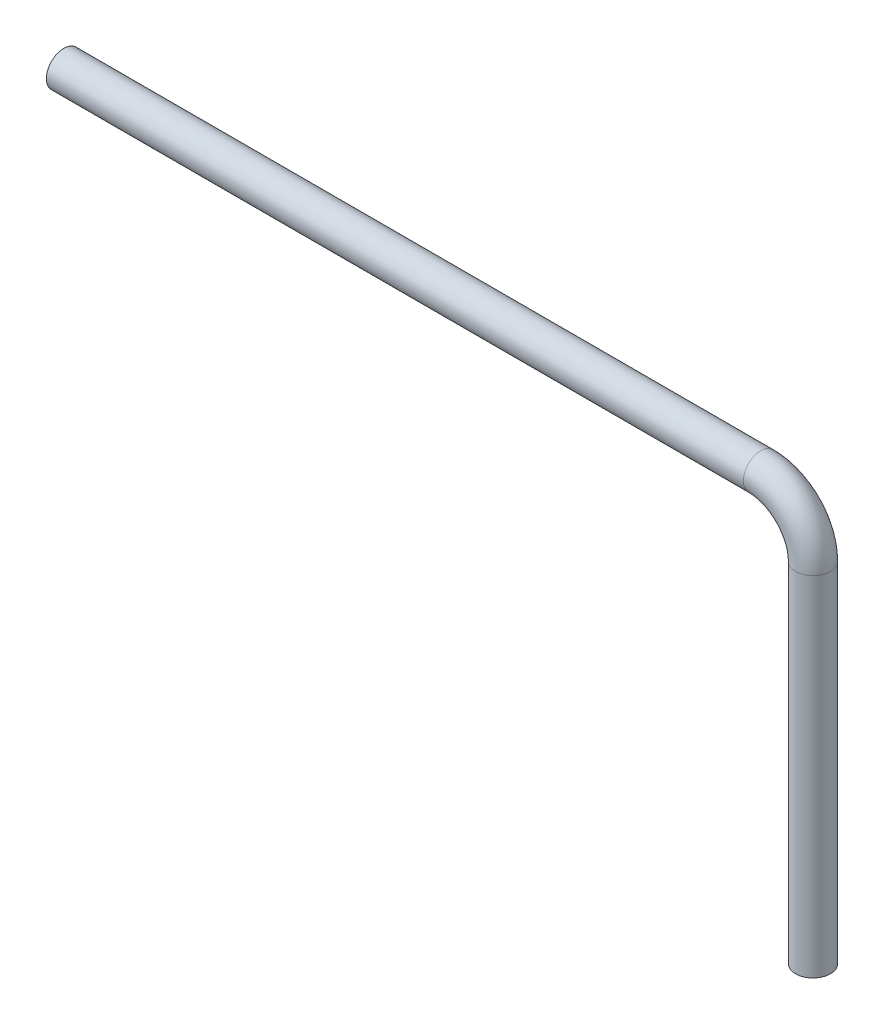
from build123d import *

# Parameters (mm, degrees)
SKETCH2_R = 25


with BuildPart() as part:
    # Sweep1: sweep along a path in Sketch1
    with BuildLine(Plane.XY) as sweep1_path:
        Line((0, 0), (0, 500))
        ThreePointArc((0, 500), (-21.966991411, 553.033008589), (-75, 575))
        Line((-75, 575), (-1075, 575))
    # Sketch2 → Sweep1 (sweep)
    with BuildSketch(Plane(origin=(0, 0, 0), x_dir=(1, 0, 0), z_dir=(0, 1, 0))):
        Circle(SKETCH2_R)
    sweep(path=sweep1_path.line)


solid = part.part
